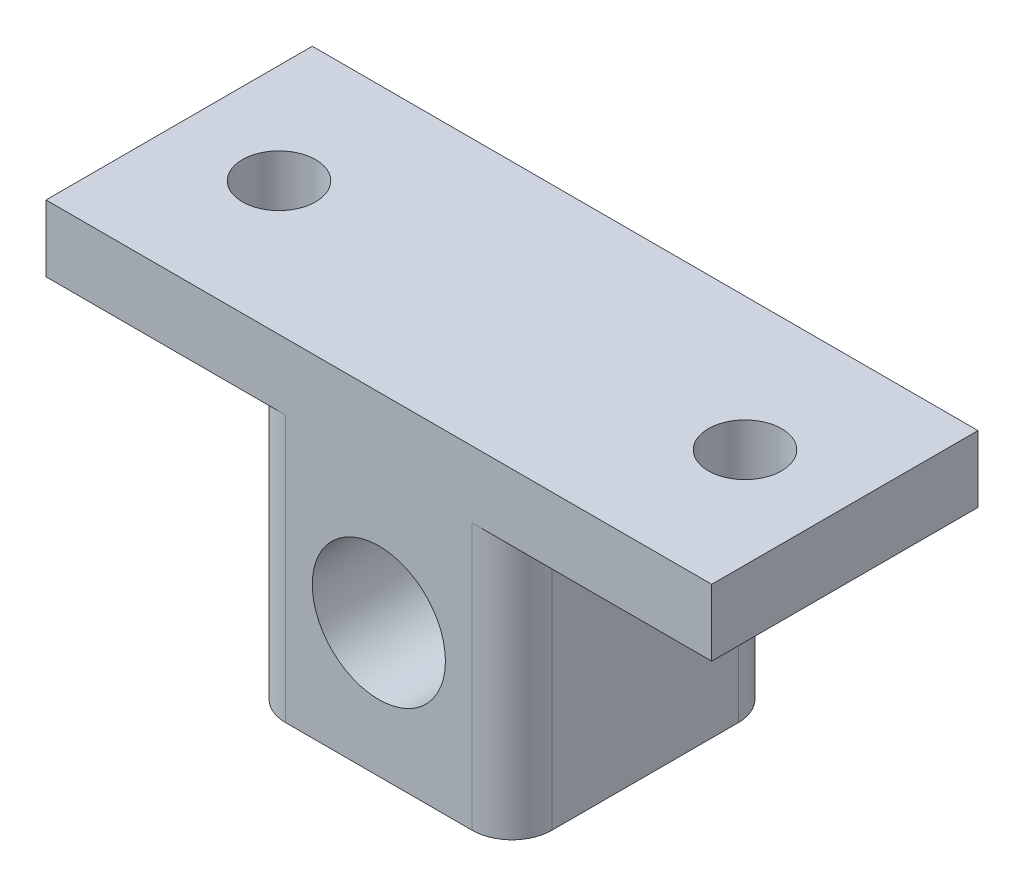
from build123d import *

# Parameters (mm, degrees)
AUFSATZ_LINEAR_AUSTRAGEN1_DEPTH = 20
SKIZZE2_R                       = 5
SCHNITT_LINEAR_AUSTRAGEN1_DEPTH = 20
SKIZZE3_R                       = 2.75
SCHNITT_LINEAR_AUSTRAGEN2_DEPTH = 20
VERRUNDUNG1_R                   = 3


with BuildPart() as part:
    # Skizze1 → Aufsatz-Linear austragen1 (new body)
    with BuildSketch(Plane.XY):
        Polygon((-34.43835366, 0), (-34.43835366, 20), (-49.43835366, 20), (-49.43835366, 25), (-24.43835366, 25), (0.56164634, 25), (0.56164634, 20), (-14.43835366, 20), (-14.43835366, 0), (-24.43835366, 0), align=None)
    extrude(amount=AUFSATZ_LINEAR_AUSTRAGEN1_DEPTH)

    # Skizze2 → Schnitt-Linear austragen1 (cut)
    with BuildSketch(Plane.XY.offset(20)):
        with Locations((-24.43835366, 10)):
            Circle(SKIZZE2_R)
    extrude(amount=-SCHNITT_LINEAR_AUSTRAGEN1_DEPTH, mode=Mode.SUBTRACT)

    # Skizze3 → Schnitt-Linear austragen2 (cut)
    with BuildSketch(Plane(origin=(0, 25, 0), x_dir=(1, 0, 0), z_dir=(0, 1, 0))):
        with Locations(Location((-41.93835366, -10, 0), (0, 0, 180))):
            Circle(SKIZZE3_R)
        with Locations(Location((-6.93835366, -10, 0), (0, 0, 180))):
            Circle(SKIZZE3_R)
    extrude(amount=-SCHNITT_LINEAR_AUSTRAGEN2_DEPTH, mode=Mode.SUBTRACT)

    # Verrundung1
    verrundung1_edges = [part.edges().sort_by_distance(p)[0] for p in [
        (-14.43835366, 10, 20),
        (-14.43835366, 10, 0),
        (-34.43835366, 10, 20),
        (-34.43835366, 10, 0),
    ]]
    fillet(verrundung1_edges, radius=VERRUNDUNG1_R)


solid = part.part
